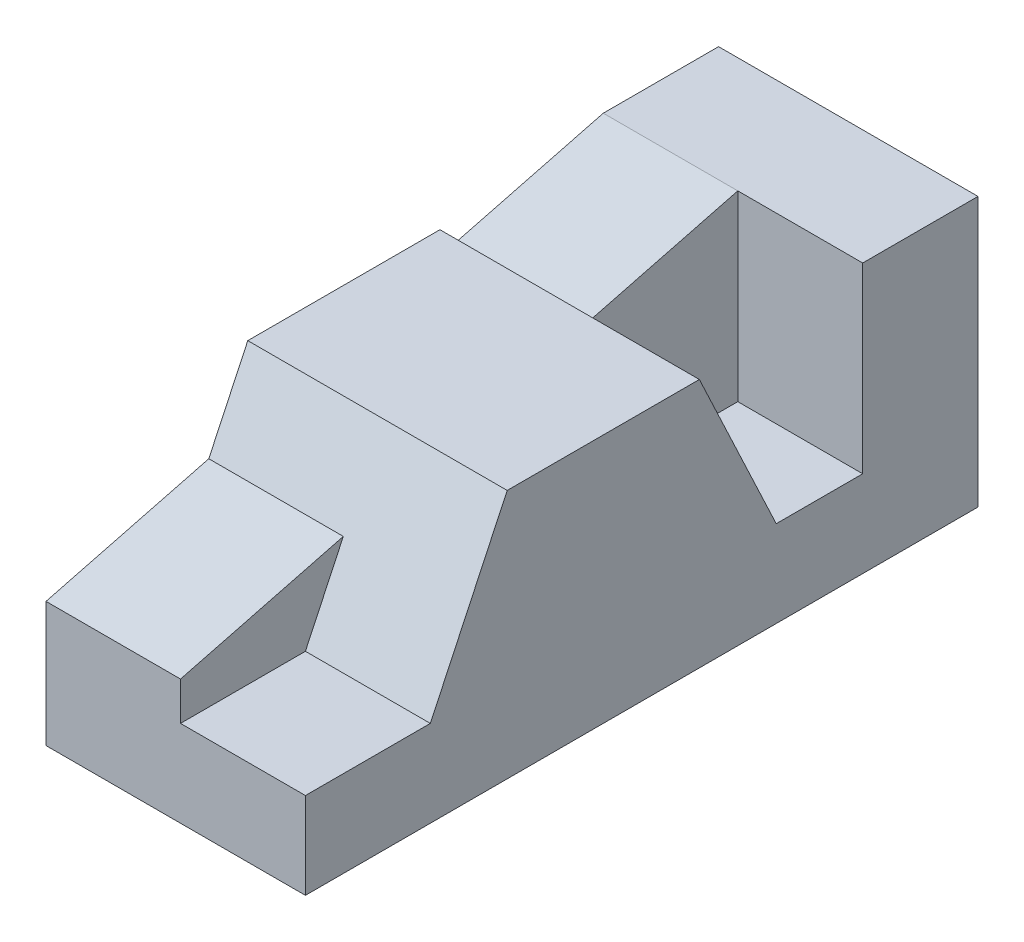
from build123d import *

# Parameters (mm, degrees)
BOSS_EXTRUDE1_DEPTH      = 135
BOSS_EXTRUDE1_DEPTH_BACK = 135
BOSS_EXTRUDE2_DEPTH      = 140


with BuildPart() as part:
    # Sketch1 → Boss-Extrude1 (new, two sides: drawn at the far end of the back side and taken through both)
    with BuildSketch(Plane(origin=(0, 0, 0), x_dir=(0, 0, -1), z_dir=(1, 0, 0)).offset(-BOSS_EXTRUDE1_DEPTH_BACK)):
        Polygon((-350, 90), (-350, 0), (350, 0), (350, 280), (230, 280), (230, 90), (140, 90), (60, 260), (-140, 260), (-220, 90), align=None)
    extrude(amount=BOSS_EXTRUDE1_DEPTH + BOSS_EXTRUDE1_DEPTH_BACK)

    # Sketch3 → Boss-Extrude2 (add)
    with BuildSketch(Plane.ZY.offset(135)):
        Polygon((350, 90), (350, 130), (180.554272517, 173.822170901), (220, 90), align=None)
        Polygon((-230, 280), (-230, 90), (-140, 90), (-70.054249548, 238.634719711), align=None)
    extrude(amount=-BOSS_EXTRUDE2_DEPTH)


solid = part.part
